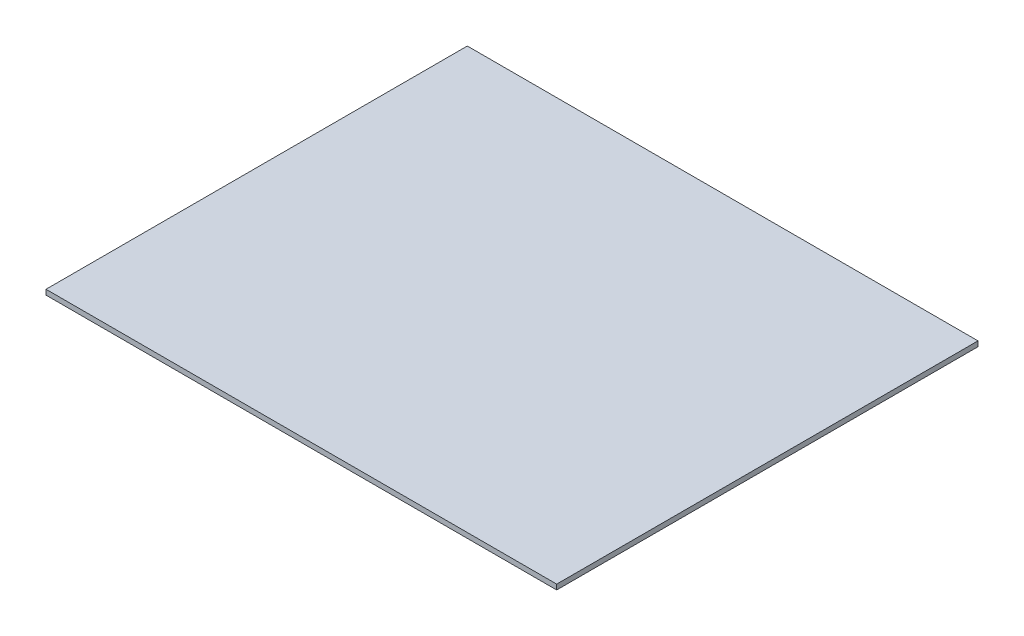
from build123d import *

# Parameters (mm, degrees)
IZIM1_W                     = 400
IZIM1_H                     = 330
Y_KSEKLIK_EKSTR_ZYON1_DEPTH = 4


with BuildPart() as part:
    # Çizim1 → Yükseklik-Ekstrüzyon1 (new body)
    with BuildSketch(Plane(origin=(0, 0, 0), x_dir=(1, 0, 0), z_dir=(0, 1, 0))):
        Rectangle(IZIM1_W, IZIM1_H)
    extrude(amount=Y_KSEKLIK_EKSTR_ZYON1_DEPTH)


solid = part.part
